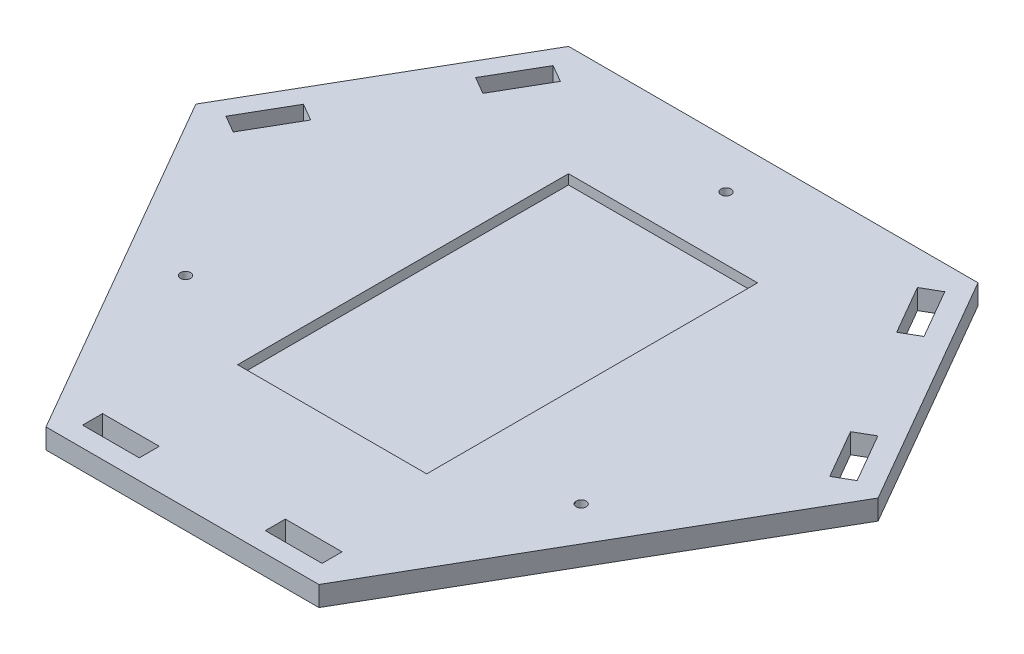
from build123d import *

# Parameters (mm, degrees)
BOSS_EXTRUDE1_DEPTH = 6.35
SKETCH2_W           = 18
SKETCH2_H           = 6.35
CUT_EXTRUDE1_DEPTH  = 148.509567486
SKETCH4_W           = 60
SKETCH4_H           = 105
CUT_EXTRUDE2_DEPTH  = 3.1
SKETCH5_R           = 1.6
CUT_EXTRUDE3_DEPTH  = 148.509567486


with BuildPart() as part:
    # Sketch1 → Boss-Extrude1 (new body)
    with BuildSketch(Plane(origin=(0, 0, 0), x_dir=(1, 0, 0), z_dir=(0, 1, 0))):
        Polygon((64.951905284, 87.5), (-64.951905284, 87.5), (-108.253175473, 12.5), (-43.301270189, -100), (43.301270189, -100), (108.253175473, 12.5), align=None)
    extrude(amount=BOSS_EXTRUDE1_DEPTH)

    # Sketch2 → Cut-Extrude1 (cut, through all)
    with BuildSketch(Plane(origin=(0, 6.35, 0), x_dir=(1, 0, 0), z_dir=(0, 1, 0))):
        with Locations((-29, -90.525)):
            Rectangle(SKETCH2_W, SKETCH2_H)
        with Locations((29, -90.525)):
            Rectangle(SKETCH2_W, SKETCH2_H)
        Polygon((-62.146580335, 79.758965344), (-56.647319021, 76.583965344), (-65.647319021, 60.995508076), (-71.146580335, 64.170508076), align=None)
        Polygon((-94.647319021, 10.766034656), (-85.647319021, 26.354491924), (-91.146580335, 29.529491924), (-100.146580335, 13.941034656), align=None)
        Polygon((100.146580335, 13.941034656), (91.146580335, 29.529491924), (85.647319021, 26.354491924), (94.647319021, 10.766034656), align=None)
        Polygon((56.647319021, 76.583965344), (62.146580335, 79.758965344), (71.146580335, 64.170508076), (65.647319021, 60.995508076), align=None)
    extrude(amount=-CUT_EXTRUDE1_DEPTH, mode=Mode.SUBTRACT)

    # Sketch4 → Cut-Extrude2 (cut)
    with BuildSketch(Plane(origin=(0, 6.35, 0), x_dir=(1, 0, 0), z_dir=(0, 1, 0))):
        Rectangle(SKETCH4_W, SKETCH4_H)
    extrude(amount=-CUT_EXTRUDE2_DEPTH, mode=Mode.SUBTRACT)

    # Sketch5 → Cut-Extrude3 (cut, through all)
    with BuildSketch(Plane(origin=(0, 6.35, 0), x_dir=(1, 0, 0), z_dir=(0, 1, 0))):
        with Locations((0, 72.5)):
            Circle(SKETCH5_R)
        with Locations((-62.786841774, -36.25)):
            Circle(SKETCH5_R)
        with Locations((62.786841774, -36.25)):
            Circle(SKETCH5_R)
    extrude(amount=-CUT_EXTRUDE3_DEPTH, mode=Mode.SUBTRACT)


solid = part.part
